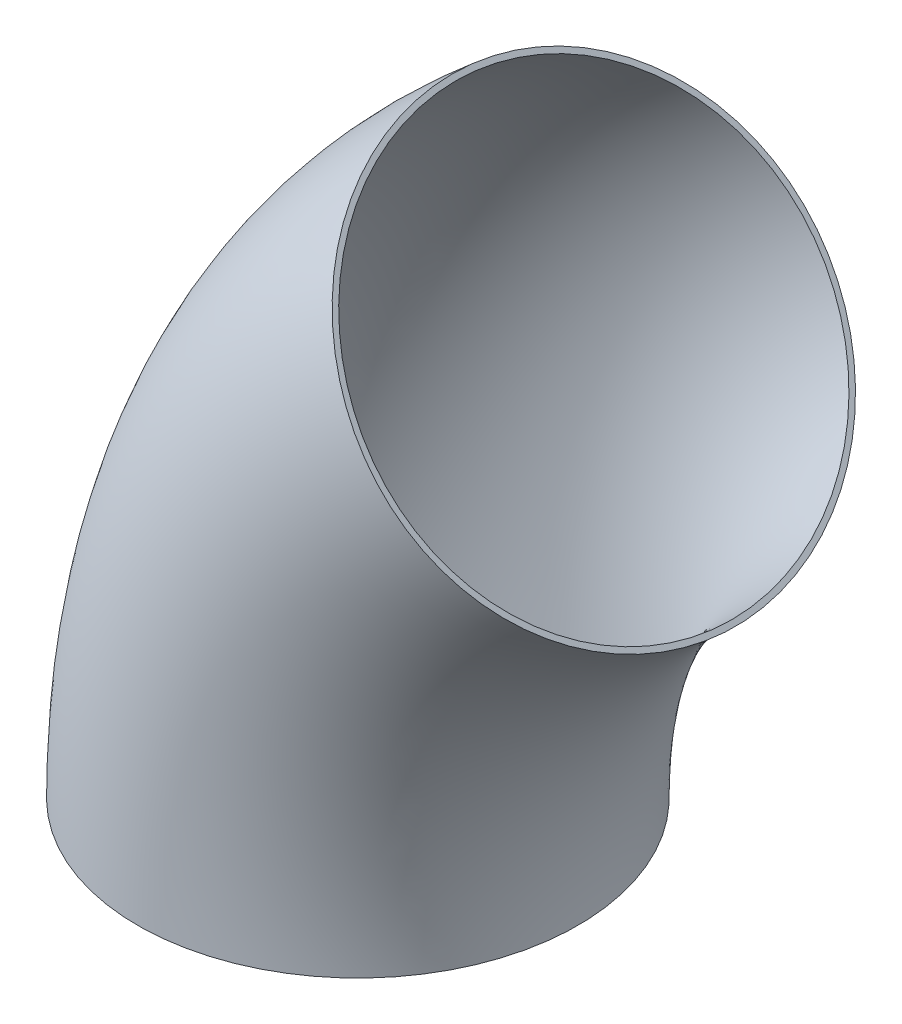
from build123d import *

# Parameters (mm, degrees)
SCHIZZO3_R   = 40
SCHIZZO3_R_2 = 39


with BuildPart() as part:
    # Sweep-Sottile1: sweep along a path in Schizzo1
    with BuildLine(Plane.XY) as sweep_sottile1_path:
        ThreePointArc((-77.134513162, 91.925333174), (-108.756934444, 50.714191409), (-120, 0))
    # Schizzo3 → Sweep-Sottile1 (sweep)
    with BuildSketch(Plane(origin=(0, 0, 0), x_dir=(1, 0, 0), z_dir=(0, 1, 0))):
        with Locations((-120.050215796, 0)):
            Circle(SCHIZZO3_R)
        with Locations((-120.050215796, 0)):
            Circle(SCHIZZO3_R_2, mode=Mode.SUBTRACT)
    sweep(path=sweep_sottile1_path.line)


solid = part.part
